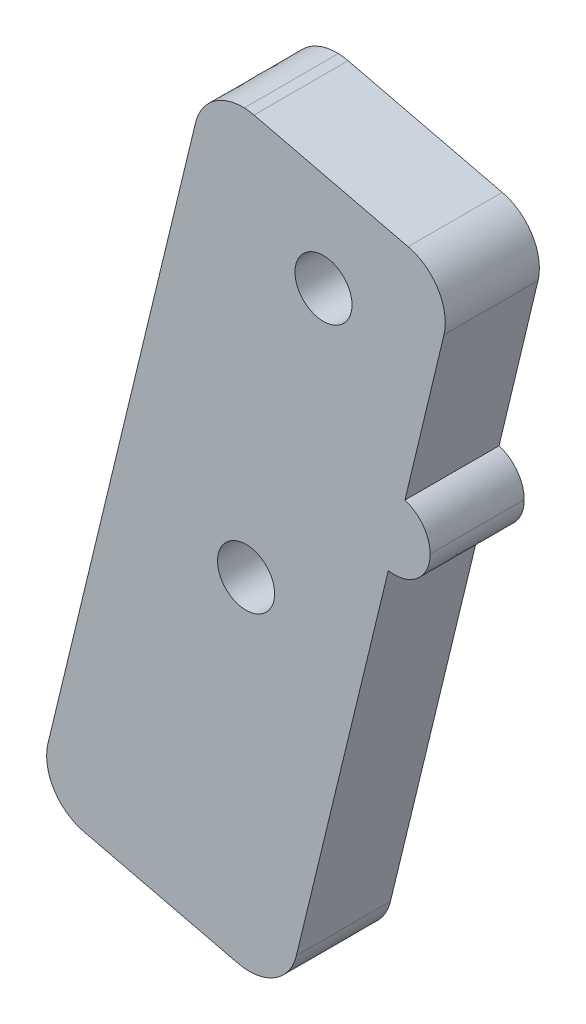
from build123d import *

# Parameters (mm, degrees)
MODEL_R             = 1.925069784
BOSS_EXTRUDE1_DEPTH = 6.35


with BuildPart() as part:
    # Model → Boss-Extrude1 (new body)
    with BuildSketch(Plane.XY):
        with BuildLine():
            Line((-262.8855, 77.7663), (-272.8434, 36.5132))
            add(Edge.make_bspline(
                [(-272.8434, 36.5132), (-273.2663, 34.7494), (-272.1875, 32.9898), (-270.4236, 32.5666)],
                knots=[0.142857143, 0.142857143, 0.142857143, 0.142857143, 0.214285714, 0.214285714, 0.214285714, 0.214285714], degree=3))
            Line((-270.4236, 32.5666), (-260.0278, 30.0723))
            add(Edge.make_bspline(
                [(-260.0278, 30.0723), (-258.2636, 29.6496), (-256.5027, 30.7281), (-256.0795, 32.4923)],
                knots=[0.285714286, 0.285714286, 0.285714286, 0.285714286, 0.357142857, 0.357142857, 0.357142857, 0.357142857], degree=3))
            Line((-256.0795, 32.4923), (-249.8766, 58.0964))
            add(Edge.make_bspline(
                [(-249.8766, 58.0964), (-249.742, 58.0727), (-249.6054, 58.0619), (-249.4692, 58.0619)],
                knots=[0.428571429, 0.428571429, 0.428571429, 0.428571429, 0.5, 0.5, 0.5, 0.5], degree=3))
            add(Edge.make_bspline(
                [(-249.4692, 58.0619), (-248.1365, 58.0619), (-247.0559, 59.1417), (-247.0559, 60.4748)],
                knots=[0.5, 0.5, 0.5, 0.5, 0.571428571, 0.571428571, 0.571428571, 0.571428571], degree=3))
            add(Edge.make_bspline(
                [(-247.0559, 60.4748), (-247.0559, 61.5318), (-247.744, 62.4645), (-248.7524, 62.7785)],
                knots=[0.571428571, 0.571428571, 0.571428571, 0.571428571, 0.642857143, 0.642857143, 0.642857143, 0.642857143], degree=3))
            Line((-248.7524, 62.7785), (-246.1231, 73.7453))
            add(Edge.make_bspline(
                [(-246.1231, 73.7453), (-245.7003, 75.5091), (-246.7789, 77.27), (-248.5431, 77.6932)],
                knots=[0.714285714, 0.714285714, 0.714285714, 0.714285714, 0.785714286, 0.785714286, 0.785714286, 0.785714286], degree=3))
            Line((-248.5431, 77.6932), (-258.9389, 80.1862))
            add(Edge.make_bspline(
                [(-258.9389, 80.1862), (-259.1594, 80.2398), (-259.3787, 80.2689), (-259.5963, 80.2772)],
                knots=[0.857142857, 0.857142857, 0.857142857, 0.857142857, 1, 1, 1, 1], degree=3))
            add(Edge.make_bspline(
                [(-259.5963, 80.2772), (-261.1217, 80.3295), (-262.5167, 79.3095), (-262.8855, 77.7663)],
                knots=[0, 0, 0, 0, 0.071428571, 0.071428571, 0.071428571, 0.071428571], degree=3))
        make_face()
        with Locations((-254.25285, 72.3954)):
            Circle(MODEL_R, mode=Mode.SUBTRACT)
        with Locations((-259.47565, 52.9045)):
            Circle(MODEL_R, mode=Mode.SUBTRACT)
    extrude(amount=BOSS_EXTRUDE1_DEPTH)


solid = part.part
